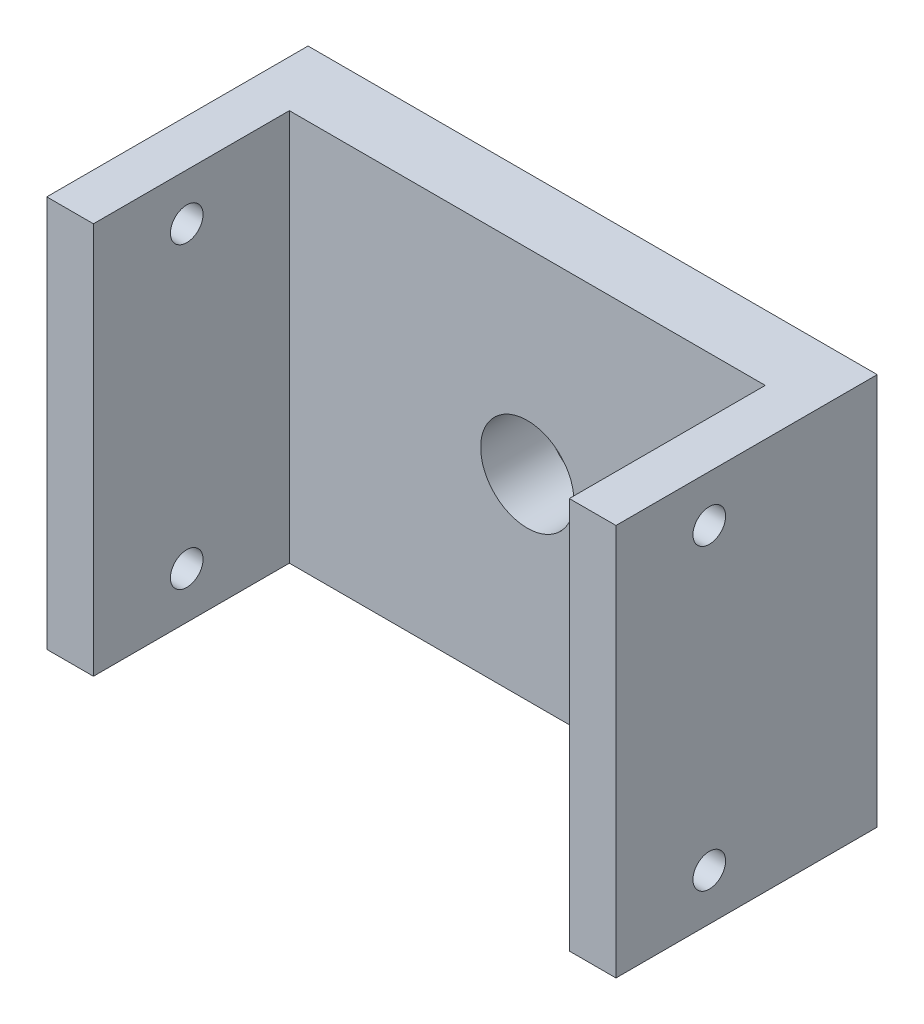
from build123d import *

# Parameters (mm, degrees)
SKETCH1_W           = 61
SKETCH1_H           = 42
SKETCH1_R           = 5
BOSS_EXTRUDE1_DEPTH = 7
SKETCH2_W           = 5
SKETCH2_H           = 42
BOSS_EXTRUDE2_DEPTH = 21
SKETCH3_R           = 1.75
CUT_EXTRUDE1_DEPTH  = 71.32780389


with BuildPart() as part:
    # Sketch1 → Boss-Extrude1 (new body)
    with BuildSketch(Plane.XY):
        Rectangle(SKETCH1_W, SKETCH1_H)
        Circle(SKETCH1_R, mode=Mode.SUBTRACT)
    extrude(amount=BOSS_EXTRUDE1_DEPTH)

    # Sketch2 → Boss-Extrude2 (add)
    with BuildSketch(Plane.XY.offset(7)):
        with Locations((-28, 0)):
            Rectangle(SKETCH2_W, SKETCH2_H)
        with Locations((28, 0)):
            Rectangle(SKETCH2_W, SKETCH2_H)
    extrude(amount=BOSS_EXTRUDE2_DEPTH)

    # Sketch3 → Cut-Extrude1 (cut, through all)
    with BuildSketch(Plane(origin=(30.5, 0, 0), x_dir=(0, 0, -1), z_dir=(1, 0, 0))):
        with Locations(Location((-18, 16, 0), (0, 0, 90))):
            Circle(SKETCH3_R)
        with Locations((-18, -16)):
            Circle(SKETCH3_R)
    extrude(amount=-CUT_EXTRUDE1_DEPTH, mode=Mode.SUBTRACT)


solid = part.part
